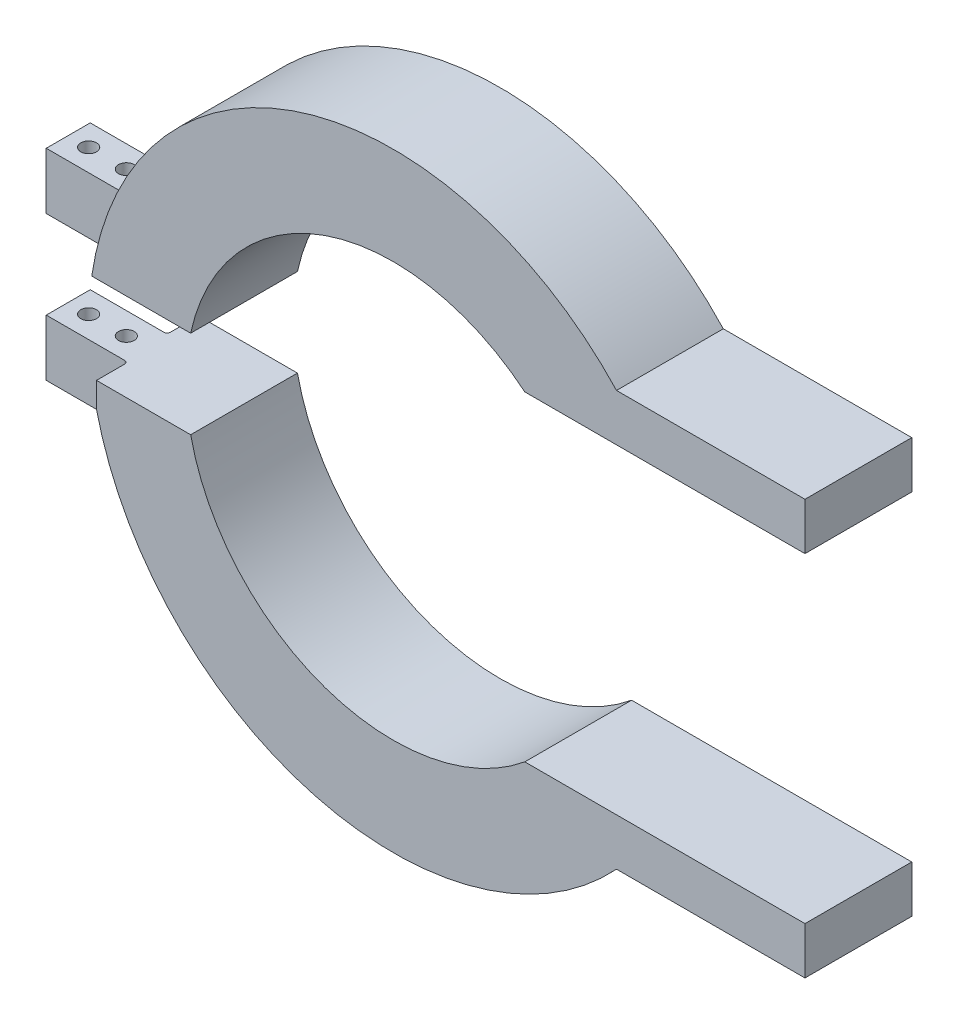
from build123d import *

# Parameters (mm, degrees)
BOSS_EXTRUDE1_DEPTH   = 7
BOSS_EXTRUDE1_2_DEPTH = 7
BOSS_EXTRUDE2_DEPTH   = 5
BOSS_EXTRUDE3_START   = 5
BOSS_EXTRUDE3_DEPTH   = 5
SKETCH9_W             = 13
SKETCH9_H             = 7.000000000000001
BOSS_EXTRUDE4_DEPTH   = 5
SKETCH10_W            = 13
SKETCH10_H            = 7.000000000000001
BOSS_EXTRUDE5_DEPTH   = 5
CUT_EXTRUDE2_REACH    = 94.736
SKETCH11_R            = 1.2499999999999976
SKETCH11_R_2          = 1.2500000000000044
BOSS_EXTRUDE6_REACH   = 125.35
SKETCH12_W            = 7.000000000000001
SKETCH12_H            = 5
FILLET3_R             = 0.5
FILLET4_R             = 0.5


with BuildPart() as part:
    # Sketch1 → Boss-Extrude1 (new body)
    with BuildSketch(Plane.XY):
        with BuildLine():
            ThreePointArc((20.94636006565342, 25.5), (-10.840556403898217, 31.168611404005503), (-32.249394973924254, 6.99832292880438))
            Line((-32.249394973924254, 6.99832292880438), (-60.23610906922786, 6.999999999999992))
            Line((-60.23610906922786, 6.999999999999992), (-60.23610906922786, 10.999999999999993))
            Line((-60.23610906922786, 10.999999999999993), (-47.23610906922786, 11))
            ThreePointArc((-47.23610906922786, 11), (-12.457395845309785, 46.872841697013044), (35.54222840509562, 33))
            Line((35.54222840509562, 33), (65.54222840509566, 33.00000000000006))
            Line((65.54222840509566, 33.00000000000006), (65.54222840509566, 25.5))
            Line((65.54222840509566, 25.5), (20.94636006565342, 25.5))
        make_face()
    extrude(amount=BOSS_EXTRUDE1_DEPTH)



with BuildPart() as body_2:
    # Sketch1 → Boss-Extrude1 2 (new body)
    with BuildSketch(Plane.XY):
        with BuildLine():
            ThreePointArc((-32.24903099319419, -7.000000000000025), (-10.839745962155684, -31.16889326678009), (20.94636006565327, -25.500000000000124))
            Line((20.94636006565327, -25.500000000000124), (65.54222840509566, -25.5))
            Line((65.54222840509566, -25.5), (65.54222840509566, -33))
            Line((65.54222840509566, -33), (35.54222840509578, -33))
            ThreePointArc((35.54222840509578, -33), (-12.45739584530974, -46.8728416970131), (-47.23610906922786, -10.99999999999999))
            Line((-47.23610906922786, -10.99999999999999), (-60.23610906922786, -11.000000000000007))
            Line((-60.23610906922786, -11.000000000000007), (-60.23610906922786, -7.000000000000008))
            Line((-60.23610906922786, -7.000000000000008), (-32.24903099319419, -7.000000000000025))
        make_face()
    extrude(amount=BOSS_EXTRUDE1_2_DEPTH)


with BuildPart() as part_1:
    add(part.part)

    add(body_2.part)  # Boss-Extrude2 merges body 2
    # Sketch7 → Boss-Extrude2 (add)
    with BuildSketch(Plane.XY.offset(7)):
        with BuildLine():
            Line((-47.23610906922786, -10.99999999999999), (-47.23610906922786, -7.000000000000016))
            Line((-47.23610906922786, -7.000000000000016), (-32.24903099319419, -7.000000000000025))
            ThreePointArc((-32.24903099319419, -7.000000000000025), (-10.839745962155684, -31.16889326678009), (20.94636006565327, -25.500000000000124))
            Line((20.94636006565327, -25.500000000000124), (65.54222840509566, -25.5))
            Line((65.54222840509566, -25.5), (65.54222840509566, -33))
            Line((65.54222840509566, -33), (35.54222840509578, -33))
            ThreePointArc((35.54222840509578, -33), (-12.45739584530974, -46.8728416970131), (-47.23610906922786, -10.99999999999999))
        make_face()
        with BuildLine():
            Line((20.94636006565342, 25.5), (65.54222840509566, 25.5))
            Line((65.54222840509566, 25.5), (65.54222840509566, 33.00000000000006))
            Line((65.54222840509566, 33.00000000000006), (35.54222840509562, 33))
            ThreePointArc((35.54222840509562, 33), (-14.413901995191612, 46.30863234077419), (-47.99229387318852, 6.999266303656799))
            Line((-47.99229387318852, 6.999266303656799), (-32.249394973924254, 6.998322928804379))
            ThreePointArc((-32.249394973924254, 6.998322928804379), (-10.840556403898217, 31.168611404005503), (20.94636006565342, 25.5))
        make_face()
    extrude(amount=BOSS_EXTRUDE2_DEPTH)

    # Sketch8 → Boss-Extrude3 (add)
    with BuildSketch(Plane(origin=(0, 0, 0), x_dir=(-1, 0, 0), z_dir=(0, 0, -1)).offset(BOSS_EXTRUDE3_START)):
        with BuildLine():
            ThreePointArc((32.24903099319419, 7.000000000000025), (10.839745962155687, 31.16889326678009), (-20.94636006565327, 25.500000000000124))
            Line((-20.94636006565327, 25.500000000000124), (-65.54222840509566, 25.5))
            Line((-65.54222840509566, 25.5), (-65.54222840509566, 33))
            Line((-65.54222840509566, 33), (-35.54222840509565, 32.999999999999986))
            ThreePointArc((-35.54222840509565, 32.999999999999986), (14.41354801594032, 46.30874251793252), (47.9921868641135, 7.000000000000016))
            Line((47.9921868641135, 7.000000000000016), (32.24903099319419, 7.000000000000025))
        make_face()
        with BuildLine():
            Line((47.9921868641135, -7.000000000000016), (32.24903099319419, -7.000000000000025))
            ThreePointArc((32.2490309931942, -7.000000000000025), (10.839745962155696, -31.168893266780103), (-20.946360065653273, -25.500000000000128))
            Line((-20.94636006565327, -25.500000000000124), (-65.54222840509566, -25.5))
            Line((-65.54222840509566, -25.5), (-65.54222840509566, -33))
            Line((-65.54222840509566, -33), (-35.54222840509565, -32.999999999999986))
            ThreePointArc((-35.54222840509565, -32.999999999999986), (12.457395845309772, -46.87284169701305), (47.23610906922784, -10.999999999999988))
            ThreePointArc((47.23610906922784, -10.999999999999988), (47.656133777217065, -9.007936134763595), (47.9921868641135, -7.000000000000023))
        make_face()
    extrude(amount=-BOSS_EXTRUDE3_DEPTH)

    # Sketch9 → Boss-Extrude4 (add)
    with BuildSketch(Plane(origin=(-5.87e-15, 11.000000000000025, 0), x_dir=(1, 5.3e-16, 0), z_dir=(-5.3e-16, 1, 0))):
        with Locations((-53.73610906922785, -3.5000000000000004)):
            Rectangle(SKETCH9_W, SKETCH9_H)
    extrude(amount=BOSS_EXTRUDE4_DEPTH)

    # Sketch10 → Boss-Extrude5 (add)
    with BuildSketch(Plane(origin=(1.468e-14, -10.999999999999927, 0), x_dir=(-1, -1.33e-15, 0), z_dir=(1.33e-15, -1, 0))):
        with Locations((53.73610906922787, -3.5000000000000004)):
            Rectangle(SKETCH10_W, SKETCH10_H)
    extrude(amount=BOSS_EXTRUDE5_DEPTH)

    # Cut-Extrude2: up to this face of the body (flat: up to its plane)
    cut_extrude2_end = Plane(part_1.part.faces().sort_by_distance((-53.736109069, -16, 3.5))[0])
    # Sketch11 → Cut-Extrude2 (cut, up to the picked face)
    with BuildSketch(Plane(origin=(-8.54e-15, 16.000000000000025, 0), x_dir=(1, 5.3e-16, 0), z_dir=(-5.3e-16, 1, 0)), mode=Mode.PRIVATE) as cut_extrude2_sk1:
        with Locations(Location((-56.986109069227844, -3.5000000000000018, 0), (0, 0, 180))):
            Circle(SKETCH11_R)
    cut_extrude2_tool1 = split(extrude(cut_extrude2_sk1.sketch, amount=-CUT_EXTRUDE2_REACH, mode=Mode.PRIVATE), bisect_by=cut_extrude2_end, keep=Keep.BOTH, mode=Mode.PRIVATE)
    # Sketch11 → Cut-Extrude2 (cut, up to the picked face)
    with BuildSketch(Plane(origin=(-8.54e-15, 16.000000000000025, 0), x_dir=(1, 5.3e-16, 0), z_dir=(-5.3e-16, 1, 0)), mode=Mode.PRIVATE) as cut_extrude2_sk2:
        with Locations(Location((-50.98610906922785, -3.5000000000000004, 0), (0, 0, 180))):
            Circle(SKETCH11_R_2)
    cut_extrude2_tool2 = split(extrude(cut_extrude2_sk2.sketch, amount=-CUT_EXTRUDE2_REACH, mode=Mode.PRIVATE), bisect_by=cut_extrude2_end, keep=Keep.BOTH, mode=Mode.PRIVATE)
    add(cut_extrude2_tool1.solids().sort_by(Axis((-56.986109, 16, 3.5), (5.3e-16, -1, 0)))[0], mode=Mode.SUBTRACT)
    add(cut_extrude2_tool2.solids().sort_by(Axis((-50.986109, 16, 3.5), (5.3e-16, -1, 0)))[0], mode=Mode.SUBTRACT)

    # Sketch12 → Boss-Extrude6 (add, up to next)
    with BuildSketch(Plane(origin=(-47.23610906922785, -2.521e-14, 0), x_dir=(0, 0, -1), z_dir=(1, 5.3e-16, 0)), mode=Mode.PRIVATE) as boss_extrude6_sk1:
        with Locations((-3.5000000000000004, -13.500000000000025)):
            Rectangle(SKETCH12_W, SKETCH12_H)
    boss_extrude6_tool1 = extrude(boss_extrude6_sk1.sketch, amount=BOSS_EXTRUDE6_REACH, mode=Mode.PRIVATE) - part_1.part
    # Sketch12 → Boss-Extrude6 (add, up to next)
    with BuildSketch(Plane(origin=(-47.23610906922785, -2.521e-14, 0), x_dir=(0, 0, -1), z_dir=(1, 5.3e-16, 0)), mode=Mode.PRIVATE) as boss_extrude6_sk2:
        with Locations((-3.5000000000000004, 13.500000000000025)):
            Rectangle(SKETCH12_W, SKETCH12_H)
    boss_extrude6_tool2 = extrude(boss_extrude6_sk2.sketch, amount=BOSS_EXTRUDE6_REACH, mode=Mode.PRIVATE) - part_1.part
    add(boss_extrude6_tool1.solids().sort_by_distance((-47.236109, -13.5, 3.5))[0])
    add(boss_extrude6_tool2.solids().sort_by_distance((-47.236109, 13.5, 3.5))[0])

    # Fillet3
    fillet3_edges = [part_1.edges().sort_by_distance(p)[0] for p in [
        (-47.104035976259524, 11.552480025831594, 7),
        (-47.10394766881262, 11.552840084314855, 0),
        (-45.784822812805444, 15.999999999999996, 3.5),
    ]]
    fillet(fillet3_edges, radius=FILLET3_R)

    # Fillet4
    fillet4_edges = [part_1.edges().sort_by_distance(p)[0] for p in [
        (-45.78482281280543, -16.000000000000046, 3.5),
        (-46.5776066586774, -13.5194880801575, 7),
        (-47.23610906922786, -9.000000000000004, 7),
        (-47.10394766881262, -11.552840084314882, 0),
    ]]
    fillet(fillet4_edges, radius=FILLET4_R)


solid = part_1.part
